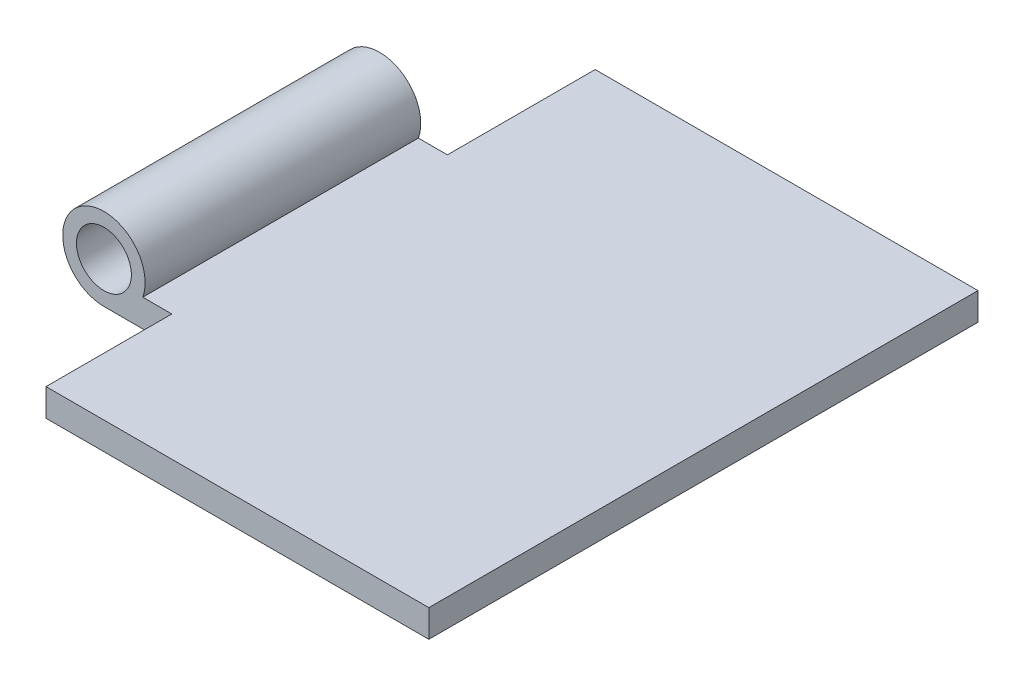
from build123d import *

# Parameters (mm, degrees)
SKETCH_1_R          = 2
EXTRUDE_1_DEPTH     = 40
SKETCH_2_W          = 10.776638496
SKETCH_2_H          = 12.262488547
SKETCH_2_H_2        = 11.437792605
CUT_EXTRUDE_2_DEPTH = 20


with BuildPart() as part:
    # Эскиз1 → Вытянуть1 (new body)
    with BuildSketch(Plane.XY):
        with BuildLine():
            Line((2.828427125, -1), (32.828427125, -1))
            Line((32.828427125, -1), (32.828427125, -3))
            Line((32.828427125, -3), (0, -3))
            ThreePointArc((0, -3), (-1.732050808, 2.449489743), (2.828427125, -1))
        make_face()
        Circle(SKETCH_1_R, mode=Mode.SUBTRACT)
    extrude(amount=EXTRUDE_1_DEPTH)

    # Эскиз2 → Вытянуть2 (cut, symmetric)
    with BuildSketch(Plane(origin=(0, 0, 0), x_dir=(1, 0, 0), z_dir=(0, 1, 0))):
        with Locations((-0.445273779, -4.631244274)):
            Rectangle(SKETCH_2_W, SKETCH_2_H)
        with Locations((-0.445273779, -36.556842192)):
            Rectangle(SKETCH_2_W, SKETCH_2_H_2)
    extrude(amount=CUT_EXTRUDE_2_DEPTH, both=True, mode=Mode.SUBTRACT)


solid = part.part
